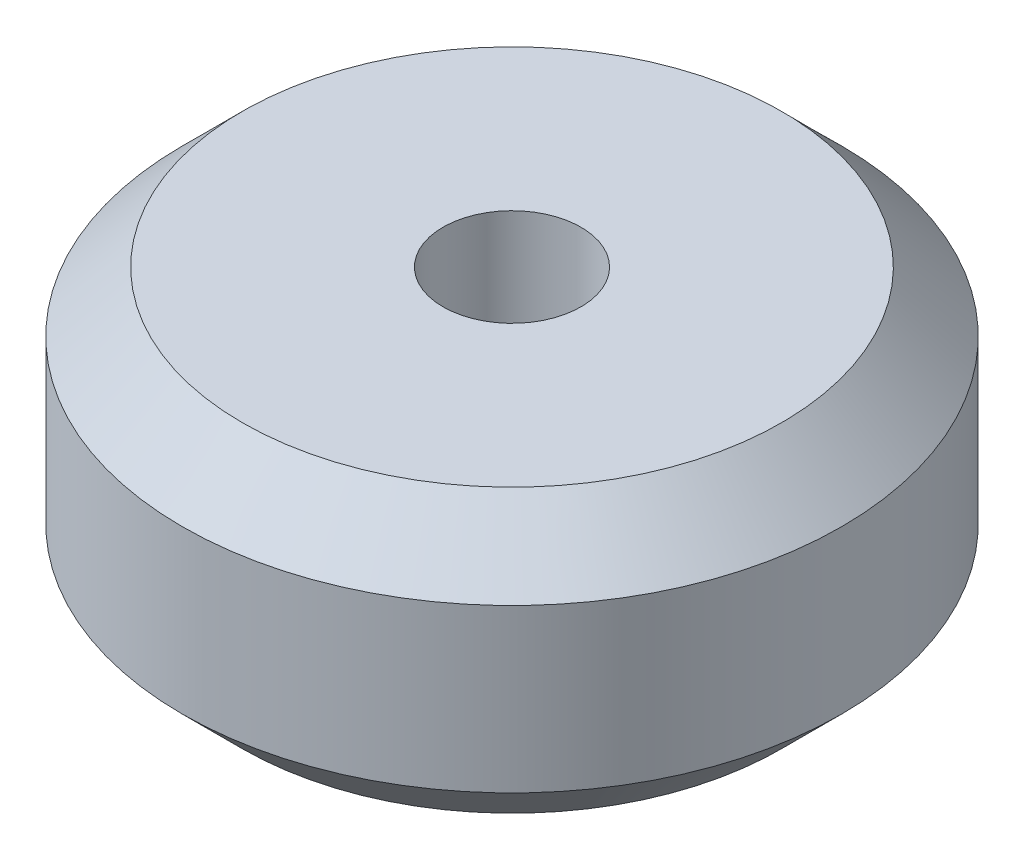
from build123d import *

# Parameters (mm, degrees)
SKETCH1_R           = 11.945
SKETCH1_R_2         = 2.5
BOSS_EXTRUDE1_DEPTH = 5.115
CHAMFER1_SIZE       = 2.175


with BuildPart() as part:
    # Sketch1 → Boss-Extrude1 (new, symmetric)
    with BuildSketch(Plane(origin=(0, 0, 0), x_dir=(1, 0, 0), z_dir=(0, 1, 0))):
        with Locations(Location((0, 0, 0), (0, 0, 270))):
            Circle(SKETCH1_R)
        with Locations(Location((0, 0, 0), (0, 0, 270))):
            Circle(SKETCH1_R_2, mode=Mode.SUBTRACT)
    extrude(amount=BOSS_EXTRUDE1_DEPTH, both=True)

    # Chamfer1
    chamfer1_edges = [part.edges().sort_by_distance(p)[0] for p in [
        (0, -5.115, -11.945),
        (0, 5.115, -11.945),
    ]]
    chamfer(chamfer1_edges, length=CHAMFER1_SIZE)


solid = part.part
